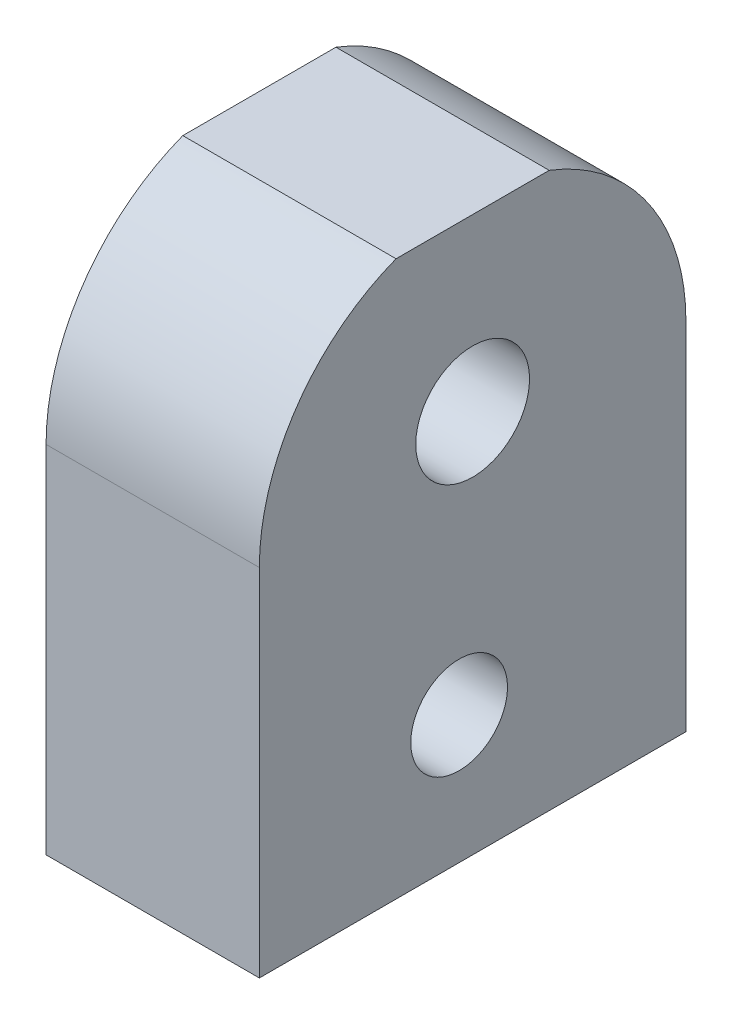
from build123d import *

# Parameters (mm, degrees)
SKETCH_1_W               = 15
SKETCH_1_H               = 30
EXTRUDE_1_DEPTH          = 25
SKETCH_3_R               = 15
EXTRUDE_3_DEPTH          = 15
CUT_EXTRUDE_2_DEPTH      = 10
SKETCH_9_R               = 6.1
CUT_EXTRUDE_3_DEPTH      = 6
SKETCH_10_R              = 4
CUT_EXTRUDE_4_DEPTH      = 51.803543184
CUT_EXTRUDE_6_DEPTH      = 53.201532545
CUT_EXTRUDE_6_DEPTH_BACK = 53.201532545
SKETCH_5_R               = 3.4
CUT_EXTRUDE_7_DEPTH      = 52.439284598


with BuildPart() as part:
    # 草图1 → 凸台-拉伸1 (new body)
    with BuildSketch(Plane(origin=(0, 0, 0), x_dir=(1, 0, 0), z_dir=(0, 1, 0))):
        with Locations((7.5, -15)):
            Rectangle(SKETCH_1_W, SKETCH_1_H)
    extrude(amount=EXTRUDE_1_DEPTH)

    # 草图3 → 凸台-拉伸3 (add)
    with BuildSketch(Plane.ZY):
        with Locations((15, 25)):
            Circle(SKETCH_3_R)
    extrude(amount=-EXTRUDE_3_DEPTH)

    # 草图4 → 切除-拉伸2 (cut)
    with BuildSketch(Plane.XZ):
        with BuildLine():
            ThreePointArc((9.15, 24), (8.666726189, 25.166726189), (7.5, 25.65))
            Line((7.5, 25.65), (7.5, 22.35))
            ThreePointArc((7.5, 22.35), (8.666726189, 22.833273811), (9.15, 24))
        make_face()
        with BuildLine():
            Line((7.5, 22.35), (7.5, 25.65))
            ThreePointArc((7.5, 25.65), (5.85, 24), (7.5, 22.35))
        make_face()
        with BuildLine():
            ThreePointArc((9.15, 6), (8.666726189, 7.166726189), (7.5, 7.65))
            Line((7.5, 7.65), (7.5, 4.35))
            ThreePointArc((7.5, 4.35), (8.666726189, 4.833273811), (9.15, 6))
        make_face()
        with BuildLine():
            Line((7.5, 4.35), (7.5, 7.65))
            ThreePointArc((7.5, 7.65), (5.85, 6), (7.5, 4.35))
        make_face()
    extrude(amount=-CUT_EXTRUDE_2_DEPTH, mode=Mode.SUBTRACT)

    # 草图9 → 切除-拉伸3 (cut)
    with BuildSketch(Plane.ZY):
        with Locations((15, 27)):
            Circle(SKETCH_9_R)
    extrude(amount=-CUT_EXTRUDE_3_DEPTH, mode=Mode.SUBTRACT)

    # 草图10 → 切除-拉伸4 (cut, through all)
    with BuildSketch(Plane.ZY.offset(-6)):
        with Locations((15, 27)):
            Circle(SKETCH_10_R)
    extrude(amount=-CUT_EXTRUDE_4_DEPTH, mode=Mode.SUBTRACT)

    # 草图12 → 切除-拉伸6 (cut, two sides: drawn at the far end of the back side and taken through both)
    with BuildSketch(Plane.ZY.offset(-CUT_EXTRUDE_6_DEPTH_BACK)):
        with BuildLine():
            ThreePointArc((20.385164807, 39), (15, 40), (9.614835193, 39))
            Line((9.614835193, 39), (20.385164807, 39))
        make_face()
    extrude(amount=CUT_EXTRUDE_6_DEPTH + CUT_EXTRUDE_6_DEPTH_BACK, mode=Mode.SUBTRACT)

    # 草图5 → 切除-拉伸7 (cut, through all)
    with BuildSketch(Plane.ZY):
        with Locations((15.95, 9)):
            Circle(SKETCH_5_R)
    extrude(amount=-CUT_EXTRUDE_7_DEPTH, mode=Mode.SUBTRACT)


solid = part.part
